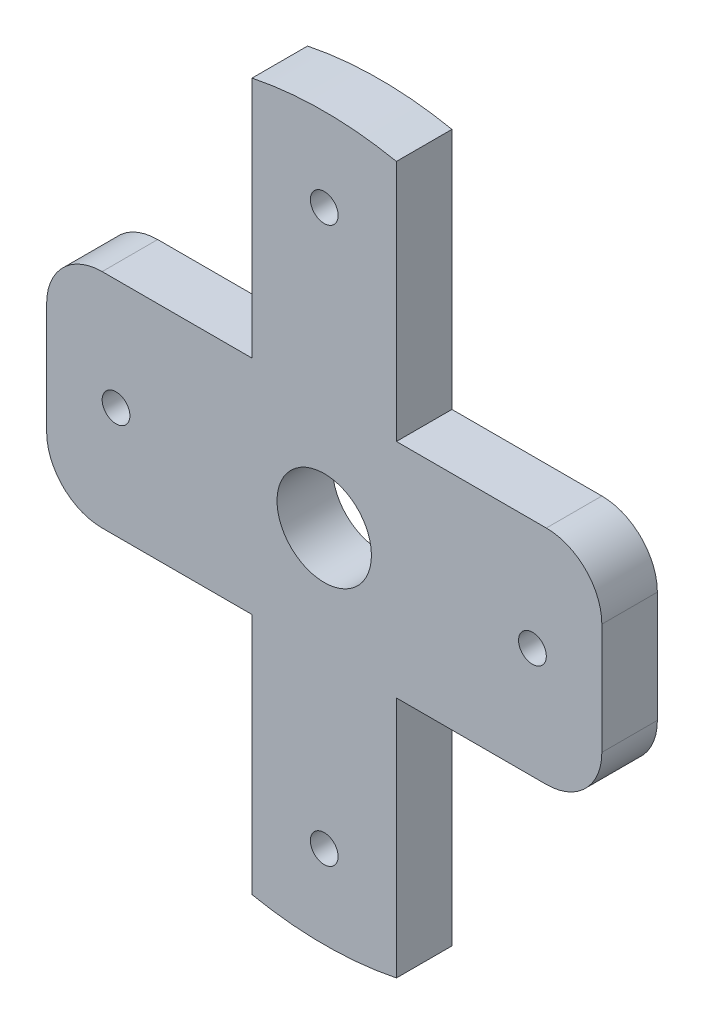
from build123d import *

# Parameters (mm, degrees)
SKETCH1_R           = 2.5
SKETCH1_R_2         = 8.5
BOSS_EXTRUDE1_DEPTH = 10


with BuildPart() as part:
    # Sketch1 → Boss-Extrude1 (new body)
    with BuildSketch(Plane.XY):
        with BuildLine():
            Line((-13, 20), (-40, 20))
            ThreePointArc((-40, 20), (-47.071067812, 17.071067812), (-50, 10))
            Line((-50, 10), (-50, -10))
            ThreePointArc((-50, -10), (-47.071067812, -17.071067812), (-40, -20))
            Line((-40, -20), (-13, -20))
            Line((-13, -20), (-13, -63.686733312))
            ThreePointArc((-13, -63.686733312), (0, -65), (13, -63.686733312))
            Line((13, -63.686733312), (13, -20))
            Line((13, -20), (40, -20))
            ThreePointArc((40, -20), (47.071067812, -17.071067812), (50, -10))
            Line((50, -10), (50, 10))
            ThreePointArc((50, 10), (47.071067812, 17.071067812), (40, 20))
            Line((40, 20), (13, 20))
            Line((13, 20), (13, 63.686733312))
            ThreePointArc((13, 63.686733312), (0, 65), (-13, 63.686733312))
            Line((-13, 63.686733312), (-13, 20))
        make_face()
        with Locations((-37.5, 0)):
            Circle(SKETCH1_R, mode=Mode.SUBTRACT)
        with Locations((0, -50)):
            Circle(SKETCH1_R, mode=Mode.SUBTRACT)
        with Locations((37.5, 0)):
            Circle(SKETCH1_R, mode=Mode.SUBTRACT)
        with Locations((0, 50)):
            Circle(SKETCH1_R, mode=Mode.SUBTRACT)
        Circle(SKETCH1_R_2, mode=Mode.SUBTRACT)
    extrude(amount=BOSS_EXTRUDE1_DEPTH)


solid = part.part
